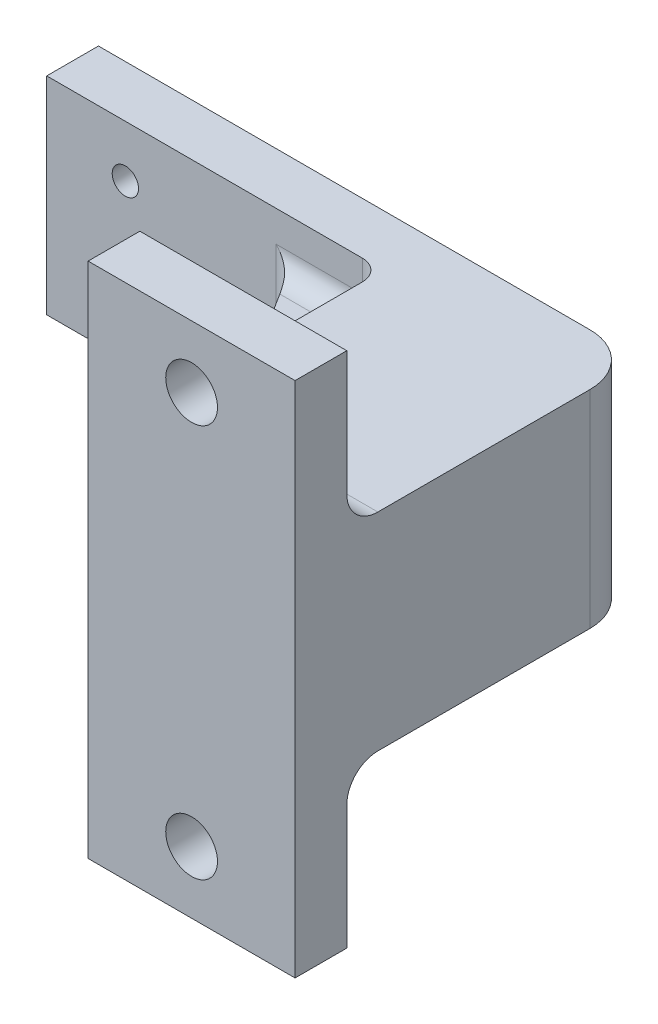
from build123d import *

# Parameters (mm, degrees)
SKETCH_1_W          = 52.5
SKETCH_1_H          = 20
SKETCH_1_R          = 1.27
SKETCH_1_R_2        = 1.25
EXTRUDE_1_DEPTH     = 5
SKETCH_2_W          = 20
SKETCH_2_H          = 20
EXTRUDE_2_DEPTH     = 28.5
SKETCH_4_W          = 20
SKETCH_4_H          = 5
EXTRUDE_3_DEPTH     = 25
SKETCH_5_R          = 2.5
CUT_EXTRUDE_1_DEPTH = 18
FILLET_1_R          = 3
RIB_1_REACH         = 69.108
SKETCH_6_WALL_W     = 153.524907632
SKETCH_6_WALL_H     = 10
FILLET_2_R          = 5
FILLET_3_R          = 2


with BuildPart() as part:
    # 草图1 → 凸台-拉伸1 (new body)
    with BuildSketch(Plane.XY):
        with Locations((26.25, -10)):
            Rectangle(SKETCH_1_W, SKETCH_1_H)
        with Locations((7.6, -5)):
            Circle(SKETCH_1_R, mode=Mode.SUBTRACT)
        with Locations((7.6, -15)):
            Circle(SKETCH_1_R_2, mode=Mode.SUBTRACT)
    extrude(amount=EXTRUDE_1_DEPTH)

    # 草图2 → 凸台-拉伸2 (add)
    with BuildSketch(Plane.XY.offset(5)):
        with Locations((42.5, -10)):
            Rectangle(SKETCH_2_W, SKETCH_2_H)
    extrude(amount=EXTRUDE_2_DEPTH)

    # 草图4 → 凸台-拉伸3 (add, symmetric)
    with BuildSketch(Plane(origin=(0, -10, 0), x_dir=(1, 0, 0), z_dir=(0, 1, 0))):
        with Locations((42.5, -31)):
            Rectangle(SKETCH_4_W, SKETCH_4_H)
    extrude(amount=EXTRUDE_3_DEPTH, both=True)

    # 草图5 → 切除-拉伸1 (cut, symmetric)
    with BuildSketch(Plane.XY.offset(33.5)):
        with Locations((42.5, 9)):
            Circle(SKETCH_5_R)
        with Locations((42.5, -29)):
            Circle(SKETCH_5_R)
    extrude(amount=CUT_EXTRUDE_1_DEPTH, both=True, mode=Mode.SUBTRACT)

    # 圆角1
    fillet_1_edges = [part.edges().sort_by_distance(p)[0] for p in [
        (42.5, -20, 28.5),
        (42.5, 0, 28.5),
    ]]
    fillet(fillet_1_edges, radius=FILLET_1_R)

    # 草图6 wall → 筋1 (add, up to next)
    with BuildSketch(Plane(origin=(27.883344013, -10, 12.320105985), x_dir=(0.533450292048, 0, 0.845831416959), z_dir=(0.845831416959, 0, -0.533450292048)), mode=Mode.PRIVATE) as rib_1_sk1:
        Rectangle(SKETCH_6_WALL_W, SKETCH_6_WALL_H)
    rib_1_tool1 = extrude(rib_1_sk1.sketch, amount=RIB_1_REACH, mode=Mode.PRIVATE) - part.part
    add(rib_1_tool1.solids().sort_by_distance((27.883344013, -10, 12.320105985))[0])

    # 圆角2
    fillet_2_edges = [part.edges().sort_by_distance(p)[0] for p in [
        (52.5, -10, 0),
    ]]
    fillet(fillet_2_edges, radius=FILLET_2_R)

    # 圆角3
    fillet_3_edges = [part.edges().sort_by_distance(p)[0] for p in [
        (32.5, -2.5, 5),
        (32.5, -17.5, 5),
        (23.266688025, -10, 5),
        (32.5, -5, 12.320105985),
        (27.883344013, -15, 5),
        (32.5, -10, 19.640211969),
        (27.883344013, -5, 5),
        (32.5, -15, 12.320105985),
    ]]
    fillet(fillet_3_edges, radius=FILLET_3_R)


solid = part.part
